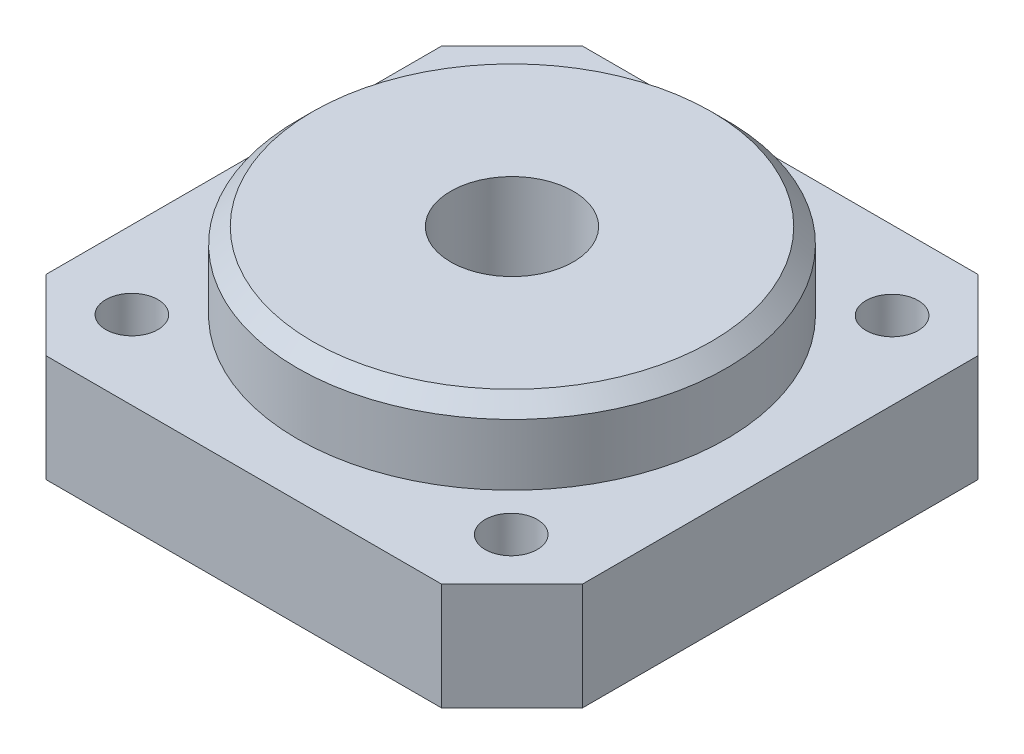
from build123d import *

# Parameters (mm, degrees)
SKETCH_1_R          = 1.7
EXTRUDE_1_DEPTH     = 7
SKETCH_2_R          = 14
EXTRUDE_2_DEPTH     = 5
CUT_EXTRUDE_1_REACH = 29.505
SKETCH_3_R          = 4
SKETCH_4_R          = 3.25
CUT_EXTRUDE_2_DEPTH = 4
CHAMFER_1_SIZE      = 1


with BuildPart() as part:
    # 草图1 → 凸台-拉伸1 (new body)
    with BuildSketch(Plane(origin=(0, 0, 0), x_dir=(1, 0, 0), z_dir=(0, 1, 0))):
        Polygon((0, 17.5), (12.905591591, 17.5), (17.5, 12.905591591), (17.5, 0), (17.5, -12.905591591), (12.905591591, -17.5), (0, -17.5), (-12.905591591, -17.5), (-17.5, -12.905591591), (-17.5, 0), (-17.5, 12.905591591), (-12.905591591, 17.5), align=None)
        with Locations(Location((12.426918465, 12.374368671, 0), (0, 0, 270))):
            Circle(SKETCH_1_R, mode=Mode.SUBTRACT)
        with Locations(Location((12.374368671, -12.426918465, 0), (0, 0, 270))):
            Circle(SKETCH_1_R, mode=Mode.SUBTRACT)
        with Locations(Location((-12.426918465, -12.374368671, 0), (0, 0, 270))):
            Circle(SKETCH_1_R, mode=Mode.SUBTRACT)
        with Locations(Location((-12.374368671, 12.426918465, 0), (0, 0, 270))):
            Circle(SKETCH_1_R, mode=Mode.SUBTRACT)
    extrude(amount=EXTRUDE_1_DEPTH)

    # 草图2 → 凸台-拉伸2 (add)
    with BuildSketch(Plane(origin=(0, 7, 0), x_dir=(1, 0, 0), z_dir=(0, 1, 0))):
        with Locations(Location((0, 0, 0), (0, 0, 270))):
            Circle(SKETCH_2_R)
    extrude(amount=EXTRUDE_2_DEPTH)

    # 草图3 → 切除-拉伸1 (cut, up to next)
    with BuildSketch(Plane(origin=(0, 12, 0), x_dir=(1, 0, 0), z_dir=(0, 1, 0)), mode=Mode.PRIVATE) as cut_extrude_1_sk1:
        with Locations(Location((0, 0, 0), (0, 0, 270))):
            Circle(SKETCH_3_R)
    cut_extrude_1_tool1 = extrude(cut_extrude_1_sk1.sketch, amount=-CUT_EXTRUDE_1_REACH, mode=Mode.PRIVATE) & part.part
    add(cut_extrude_1_tool1.solids().sort_by_distance((0, 12, 0))[0], mode=Mode.SUBTRACT)

    # 草图4 → 切除-拉伸2 (cut)
    with BuildSketch(Plane.XZ):
        with Locations(Location((-12.426918465, 12.374368671, 0), (0, 0, 270))):
            Circle(SKETCH_4_R)
        with Locations(Location((12.374368671, 12.426918465, 0), (0, 0, 270))):
            Circle(SKETCH_4_R)
        with Locations(Location((12.426918465, -12.374368671, 0), (0, 0, 270))):
            Circle(SKETCH_4_R)
        with Locations(Location((-12.374368671, -12.426918465, 0), (0, 0, 270))):
            Circle(SKETCH_4_R)
    extrude(amount=-CUT_EXTRUDE_2_DEPTH, mode=Mode.SUBTRACT)

    # 倒角1
    chamfer_1_edges = [part.edges().sort_by_distance(p)[0] for p in [
        (0, 12, -14),
    ]]
    chamfer(chamfer_1_edges, length=CHAMFER_1_SIZE)


solid = part.part
